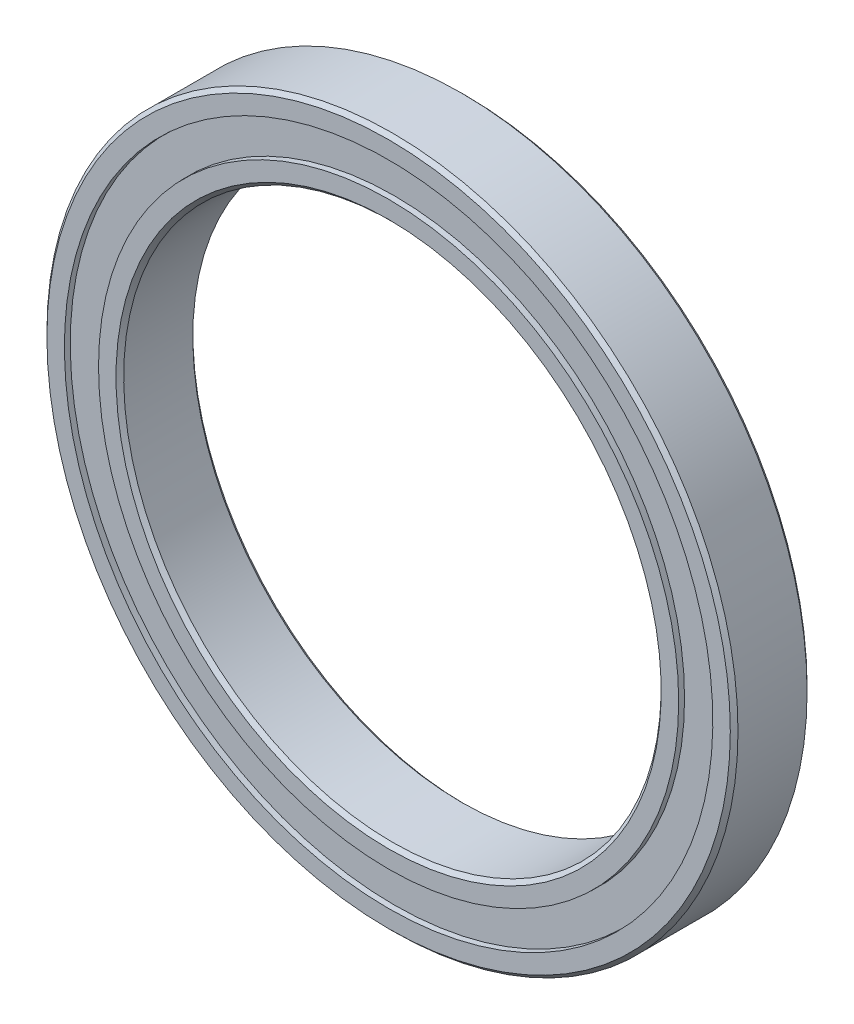
from build123d import *

# Parameters (mm, degrees)
SKETCH5_W         = 0.381
SKETCH5_H         = 4.393644444
CIRPATTERN1_COUNT = 24


with BuildPart() as part:
    # Sketch5 → Revolve1 (revolve)
    with BuildSketch(Plane(origin=(0, 0, 0), x_dir=(0, 0, -1), z_dir=(1, 0, 0)), mode=Mode.PRIVATE) as revolve1_sk:
        with BuildLine():
            Line((4.5, 45), (-4.5, 45))
            Line((-4.5, 45), (-5, 44.5))
            Line((-5, 44.5), (-5, 42.222222222))
            Line((-5, 42.222222222), (-2.222222222, 42.222222222))
            ThreePointArc((-2.222222222, 42.222222222), (0, 43.142696805), (2.222222222, 42.222222222))
            Line((2.222222222, 42.222222222), (5, 42.222222222))
            Line((5, 42.222222222), (5, 44.5))
            Line((5, 44.5), (4.5, 45))
        make_face()
        with Locations((4.071348403, 40)):
            Rectangle(SKETCH5_W, SKETCH5_H)
        with Locations((-4.071348403, 40)):
            Rectangle(SKETCH5_W, SKETCH5_H)
    revolve(revolve1_sk.sketch.rotate(Axis((0, 0, 5), (0, 0, -1)), 180), axis=Axis((0, 0, 5), (0, 0, -1)))


with BuildPart() as body_2:
    # Sketch3 → Revolve3 (revolve)
    with BuildSketch(Plane(origin=(0, 0, 0), x_dir=(0, 0, -1), z_dir=(1, 0, 0)), mode=Mode.PRIVATE) as revolve3_sk:
        with BuildLine():
            Line((-5, 37.777777778), (-2.222222222, 37.777777778))
            ThreePointArc((-2.222222222, 37.777777778), (0, 36.857303195), (2.222222222, 37.777777778))
            Line((2.222222222, 37.777777778), (5, 37.777777778))
            Line((5, 37.777777778), (5, 35.5))
            Line((5, 35.5), (4.5, 35))
            Line((4.5, 35), (-4.5, 35))
            Line((-4.5, 35), (-5, 35.5))
            Line((-5, 35.5), (-5, 37.777777778))
        make_face()
    revolve(revolve3_sk.sketch.rotate(Axis((0, 0, 5), (0, 0, -1)), 180), axis=Axis((0, 0, 5), (0, 0, -1)))


with BuildPart() as body_3:
    # Sketch4 → Revolve4 (revolve)
    with BuildSketch(Plane(origin=(0, 0, 0), x_dir=(0, 0, -1), z_dir=(1, 0, 0))):
        with BuildLine():
            Line((-3.142696805, 40), (3.142696805, 40))
            ThreePointArc((3.142696805, 40), (0, 43.142696805), (-3.142696805, 40))
        make_face()
    revolve(axis=Axis((0, 40, 3.142696805), (0, 0, -1)))


with BuildPart() as cirpattern1_1:
    # CirPattern1: pattern copy
    add(body_3.part.rotate(Axis((0, 0, 0), (0, 0, 1)), 1 * 360 / CIRPATTERN1_COUNT))


with BuildPart() as cirpattern1_2:
    # CirPattern1: pattern copy
    add(body_3.part.rotate(Axis((0, 0, 0), (0, 0, 1)), 2 * 360 / CIRPATTERN1_COUNT))


with BuildPart() as cirpattern1_3:
    # CirPattern1: pattern copy
    add(body_3.part.rotate(Axis((0, 0, 0), (0, 0, 1)), 3 * 360 / CIRPATTERN1_COUNT))


with BuildPart() as cirpattern1_4:
    # CirPattern1: pattern copy
    add(body_3.part.rotate(Axis((0, 0, 0), (0, 0, 1)), 4 * 360 / CIRPATTERN1_COUNT))


with BuildPart() as cirpattern1_5:
    # CirPattern1: pattern copy
    add(body_3.part.rotate(Axis((0, 0, 0), (0, 0, 1)), 5 * 360 / CIRPATTERN1_COUNT))


with BuildPart() as cirpattern1_6:
    # CirPattern1: pattern copy
    add(body_3.part.rotate(Axis((0, 0, 0), (0, 0, 1)), 6 * 360 / CIRPATTERN1_COUNT))


with BuildPart() as cirpattern1_7:
    # CirPattern1: pattern copy
    add(body_3.part.rotate(Axis((0, 0, 0), (0, 0, 1)), 7 * 360 / CIRPATTERN1_COUNT))


with BuildPart() as cirpattern1_8:
    # CirPattern1: pattern copy
    add(body_3.part.rotate(Axis((0, 0, 0), (0, 0, 1)), 8 * 360 / CIRPATTERN1_COUNT))


with BuildPart() as cirpattern1_9:
    # CirPattern1: pattern copy
    add(body_3.part.rotate(Axis((0, 0, 0), (0, 0, 1)), 9 * 360 / CIRPATTERN1_COUNT))


with BuildPart() as cirpattern1_10:
    # CirPattern1: pattern copy
    add(body_3.part.rotate(Axis((0, 0, 0), (0, 0, 1)), 10 * 360 / CIRPATTERN1_COUNT))


with BuildPart() as cirpattern1_11:
    # CirPattern1: pattern copy
    add(body_3.part.rotate(Axis((0, 0, 0), (0, 0, 1)), 11 * 360 / CIRPATTERN1_COUNT))


with BuildPart() as cirpattern1_12:
    # CirPattern1: pattern copy
    add(body_3.part.rotate(Axis((0, 0, 0), (0, 0, 1)), 12 * 360 / CIRPATTERN1_COUNT))


with BuildPart() as cirpattern1_13:
    # CirPattern1: pattern copy
    add(body_3.part.rotate(Axis((0, 0, 0), (0, 0, 1)), 13 * 360 / CIRPATTERN1_COUNT))


with BuildPart() as cirpattern1_14:
    # CirPattern1: pattern copy
    add(body_3.part.rotate(Axis((0, 0, 0), (0, 0, 1)), 14 * 360 / CIRPATTERN1_COUNT))


with BuildPart() as cirpattern1_15:
    # CirPattern1: pattern copy
    add(body_3.part.rotate(Axis((0, 0, 0), (0, 0, 1)), 15 * 360 / CIRPATTERN1_COUNT))


with BuildPart() as cirpattern1_16:
    # CirPattern1: pattern copy
    add(body_3.part.rotate(Axis((0, 0, 0), (0, 0, 1)), 16 * 360 / CIRPATTERN1_COUNT))


with BuildPart() as cirpattern1_17:
    # CirPattern1: pattern copy
    add(body_3.part.rotate(Axis((0, 0, 0), (0, 0, 1)), 17 * 360 / CIRPATTERN1_COUNT))


with BuildPart() as cirpattern1_18:
    # CirPattern1: pattern copy
    add(body_3.part.rotate(Axis((0, 0, 0), (0, 0, 1)), 18 * 360 / CIRPATTERN1_COUNT))


with BuildPart() as cirpattern1_19:
    # CirPattern1: pattern copy
    add(body_3.part.rotate(Axis((0, 0, 0), (0, 0, 1)), 19 * 360 / CIRPATTERN1_COUNT))


with BuildPart() as cirpattern1_20:
    # CirPattern1: pattern copy
    add(body_3.part.rotate(Axis((0, 0, 0), (0, 0, 1)), 20 * 360 / CIRPATTERN1_COUNT))


with BuildPart() as cirpattern1_21:
    # CirPattern1: pattern copy
    add(body_3.part.rotate(Axis((0, 0, 0), (0, 0, 1)), 21 * 360 / CIRPATTERN1_COUNT))


with BuildPart() as cirpattern1_22:
    # CirPattern1: pattern copy
    add(body_3.part.rotate(Axis((0, 0, 0), (0, 0, 1)), 22 * 360 / CIRPATTERN1_COUNT))


with BuildPart() as cirpattern1_23:
    # CirPattern1: pattern copy
    add(body_3.part.rotate(Axis((0, 0, 0), (0, 0, 1)), 23 * 360 / CIRPATTERN1_COUNT))


solid = Compound([part.part, body_2.part, body_3.part, cirpattern1_1.part, cirpattern1_2.part, cirpattern1_3.part, cirpattern1_4.part, cirpattern1_5.part, cirpattern1_6.part, cirpattern1_7.part, cirpattern1_8.part, cirpattern1_9.part, cirpattern1_10.part, cirpattern1_11.part, cirpattern1_12.part, cirpattern1_13.part, cirpattern1_14.part, cirpattern1_15.part, cirpattern1_16.part, cirpattern1_17.part, cirpattern1_18.part, cirpattern1_19.part, cirpattern1_20.part, cirpattern1_21.part, cirpattern1_22.part, cirpattern1_23.part])
